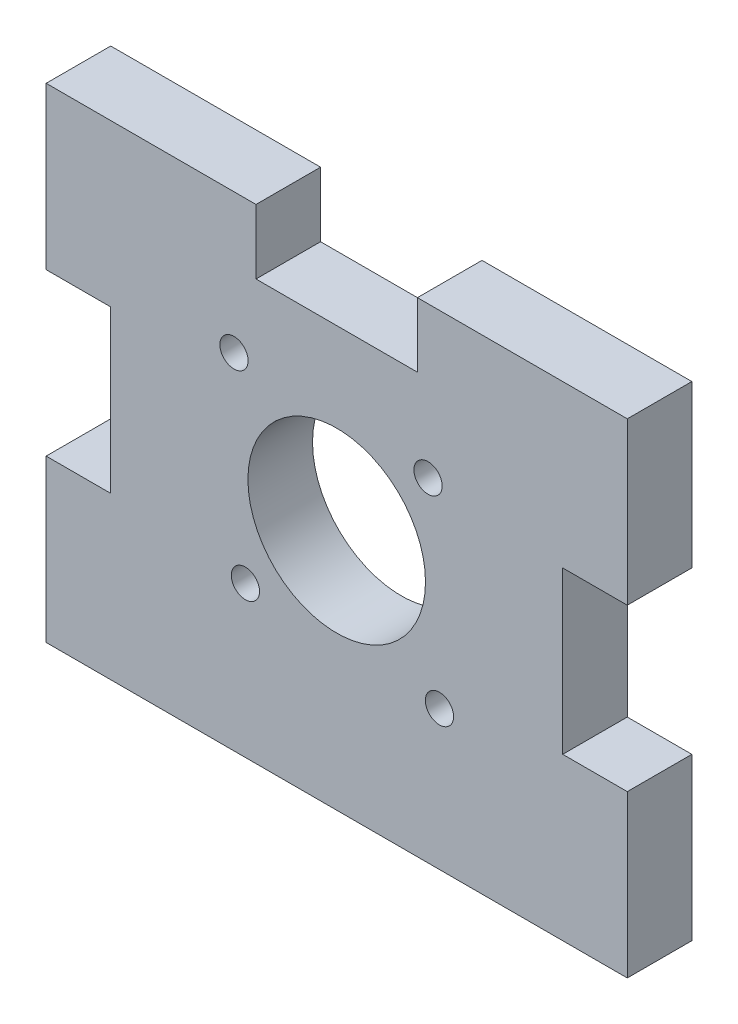
from build123d import *

# Parameters (mm, degrees)
SKIZZE1_W                       = 36
SKIZZE1_H                       = 30
AUFSATZ_LINEAR_AUSTRAGEN1_DEPTH = 4
SKIZZE2_R                       = 5.5
SKIZZE2_R_2                     = 0.875
SCHNITT_LINEAR_AUSTRAGEN1_DEPTH = 4
SKIZZE3_W                       = 4
SKIZZE3_H                       = 10
SKIZZE3_W_2                     = 10
SKIZZE3_H_2                     = 4
SCHNITT_LINEAR_AUSTRAGEN2_DEPTH = 24.769728648


with BuildPart() as part:
    # Skizze1 → Aufsatz-Linear austragen1 (new body)
    with BuildSketch(Plane.XY):
        Rectangle(SKIZZE1_W, SKIZZE1_H)
    extrude(amount=AUFSATZ_LINEAR_AUSTRAGEN1_DEPTH)

    # Skizze2 → Schnitt-Linear austragen1 (cut)
    with BuildSketch(Plane.XY.offset(4)):
        Circle(SKIZZE2_R)
        with Locations((5.656854249, 5.656854249)):
            Circle(SKIZZE2_R_2)
        with Locations((6.363961031, -6.363961031)):
            Circle(SKIZZE2_R_2)
        with Locations(Location((-5.656854249, -5.656854249, 0), (0, 0, 180))):
            Circle(SKIZZE2_R_2)
        with Locations(Location((-6.363961031, 6.363961031, 0), (0, 0, 180))):
            Circle(SKIZZE2_R_2)
    extrude(amount=-SCHNITT_LINEAR_AUSTRAGEN1_DEPTH, mode=Mode.SUBTRACT)

    # Skizze3 → Schnitt-Linear austragen2 (cut, through all)
    with BuildSketch(Plane.XY.offset(4)):
        with Locations((-16, 0)):
            Rectangle(SKIZZE3_W, SKIZZE3_H)
        with Locations((0, 13)):
            Rectangle(SKIZZE3_W_2, SKIZZE3_H_2)
        with Locations((16, 0)):
            Rectangle(SKIZZE3_W, SKIZZE3_H)
    extrude(amount=-SCHNITT_LINEAR_AUSTRAGEN2_DEPTH, mode=Mode.SUBTRACT)


solid = part.part
